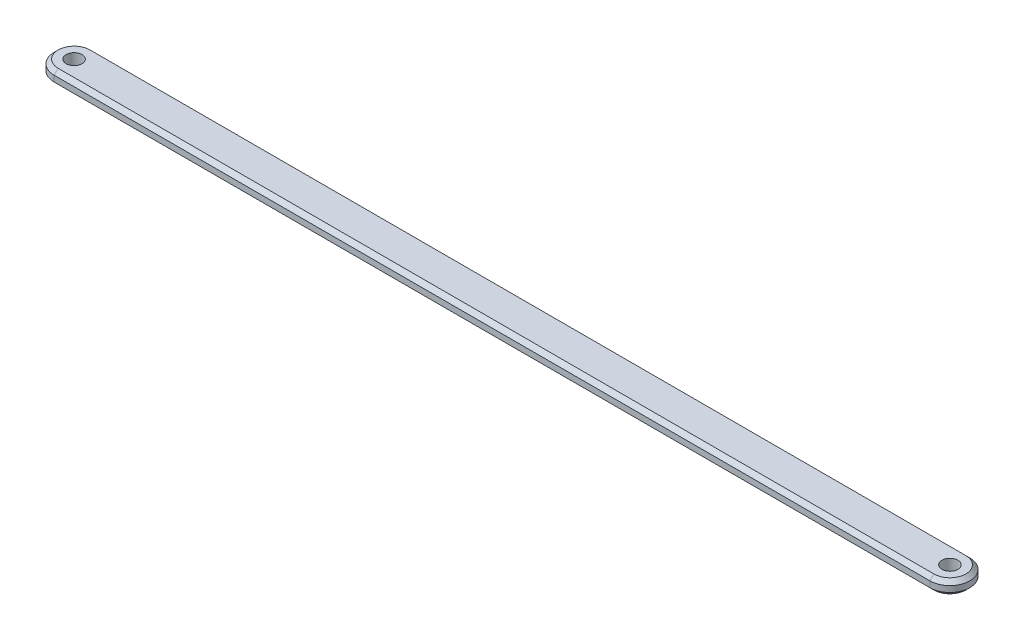
from build123d import *

# Parameters (mm, degrees)
SKETCH_1_R      = 2
EXTRUDE_1_DEPTH = 3.5
CHAMFER_1_SIZE  = 1


with BuildPart() as part:
    # 草图1 → 凸台-拉伸1 (new body)
    with BuildSketch(Plane(origin=(0, 0, 0), x_dir=(1, 0, 0), z_dir=(0, 1, 0))):
        with BuildLine():
            Line((0, 5), (220, 5))
            ThreePointArc((220, 5), (225, 0), (220, -5))
            Line((220, -5), (0, -5))
            ThreePointArc((0, -5), (-5, 0), (0, 5))
        make_face()
        with Locations(Location((0, 0, 0), (0, 0, 270))):
            Circle(SKETCH_1_R, mode=Mode.SUBTRACT)
        with Locations(Location((220, 0, 0), (0, 0, 90))):
            Circle(SKETCH_1_R, mode=Mode.SUBTRACT)
    extrude(amount=EXTRUDE_1_DEPTH)

    # 倒角1
    chamfer_1_edges = [part.edges().sort_by_distance(p)[0] for p in [
        (225, 3.5, 0),
        (110, 3.5, -5),
        (-5, 3.5, 0),
        (110, 0, -5),
        (225, 0, 0),
        (110, 0, 5),
        (-5, 0, 0),
        (110, 3.5, 5),
    ]]
    chamfer(chamfer_1_edges, length=CHAMFER_1_SIZE)


solid = part.part
